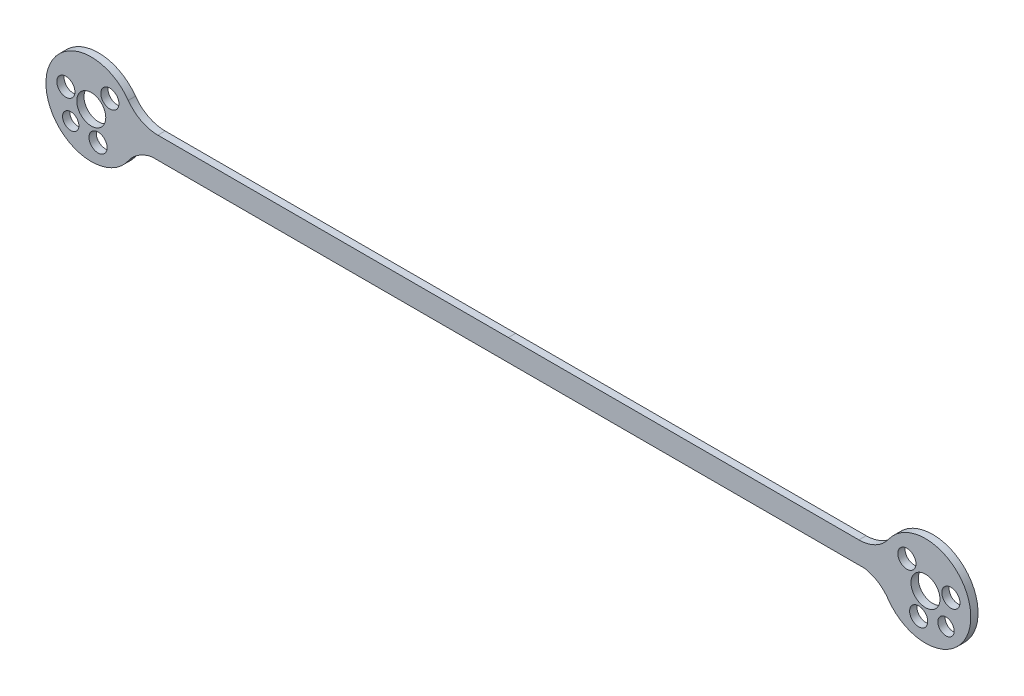
from build123d import *

# Parameters (mm, degrees)
SKETCH_1_R      = 2.25
SKETCH_1_R_2    = 2.5
SKETCH_1_R_3    = 4
EXTRUDE_1_DEPTH = 2


with BuildPart() as part:
    # 草图1 → 凸台-拉伸1 (new body)
    with BuildSketch(Plane.XY):
        with BuildLine():
            Line((-97.333495067, -2.569668399), (0.921282848, -2.569581138))
            Line((0.921282848, -2.569581138), (99.176060763, -2.569468011))
            ThreePointArc((99.176060763, -2.569468011), (102.832215453, -3.990464351), (105.660516847, -6.708443184))
            ThreePointArc((105.660516847, -6.708443184), (128.420905518, 0.379743237), (105.718891057, 7.652721898))
            ThreePointArc((105.718891057, 7.652721898), (102.151642887, 4.54858247), (97.556982938, 3.430530125))
            Line((97.556982938, 3.430530125), (0.92127673, 3.430418862))
            Line((0.92127673, 3.430418862), (-95.714429479, 3.430333039))
            ThreePointArc((-95.714429479, 3.430333039), (-100.309091708, 4.548376014), (-103.876346209, 7.652508166))
            ThreePointArc((-103.876346209, 7.652508166), (-126.578345836, 0.379483205), (-103.81794271, -6.708656797))
            ThreePointArc((-103.81794271, -6.708656797), (-100.989646859, -3.990672195), (-97.333495067, -2.569668399))
        make_face()
        with Locations((-119.735572513, -5.226431967)):
            Circle(SKETCH_1_R, mode=Mode.SUBTRACT)
        with Locations((-121.081680504, 2.30686036)):
            Circle(SKETCH_1_R_2, mode=Mode.SUBTRACT)
        with Locations((-108.9521941, 5.556946446)):
            Circle(SKETCH_1_R_2, mode=Mode.SUBTRACT)
        with Locations((-112.202280186, -6.572539958)):
            Circle(SKETCH_1_R_2, mode=Mode.SUBTRACT)
        with Locations((-114.078604371, 0.43031673)):
            Circle(SKETCH_1_R_3, mode=Mode.SUBTRACT)
        with Locations((115.921163949, 0.430551269)):
            Circle(SKETCH_1_R_3, mode=Mode.SUBTRACT)
        with Locations((110.794757573, 5.556946446)):
            Circle(SKETCH_1_R_2, mode=Mode.SUBTRACT)
        with Locations((122.924243977, 2.30686036)):
            Circle(SKETCH_1_R_2, mode=Mode.SUBTRACT)
        with Locations((121.578135986, -5.226431967)):
            Circle(SKETCH_1_R, mode=Mode.SUBTRACT)
        with Locations((114.04484366, -6.572539958)):
            Circle(SKETCH_1_R_2, mode=Mode.SUBTRACT)
    extrude(amount=EXTRUDE_1_DEPTH)


solid = part.part
